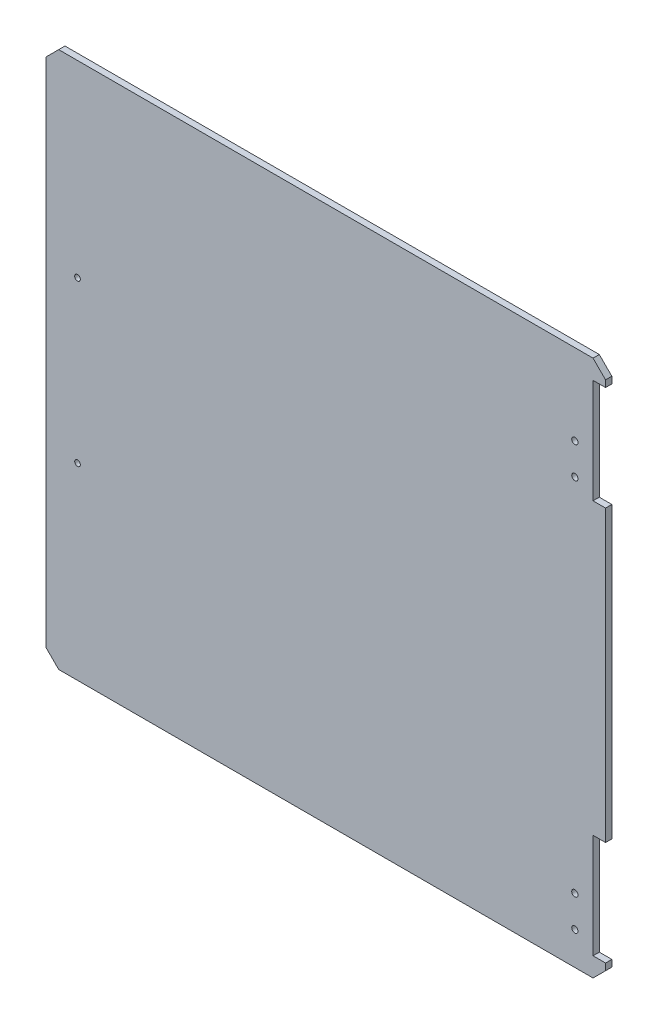
from build123d import *

# Parameters (mm, degrees)
SCHIZZO1_R                   = 2.5
SCHIZZO1_R_2                 = 2.499072061
SCHIZZO1_R_3                 = 2.25
ESTRUSIONE_ESTRUSIONE1_DEPTH = 5


with BuildPart() as part:
    # Schizzo1 → Estrusione-Estrusione1 (new body)
    with BuildSketch(Plane.XY):
        Polygon((-223, 204), (-213, 214), (213, 214), (223, 204), (223, 198.658355402), (213, 198.658355402), (213, 115.470714491), (223, 115.470714491), (223, -115.470714491), (213, -115.470714491), (213, -198.658355402), (223, -198.658355402), (223, -204), (213, -214), (-213, -214), (-223, -204), align=None)
        with Locations((198.51797805, 149.65244957)):
            Circle(SCHIZZO1_R, mode=Mode.SUBTRACT)
        with Locations((198.51797805, 124.65244957)):
            Circle(SCHIZZO1_R, mode=Mode.SUBTRACT)
        with Locations((198.494140307, -162.747561795)):
            Circle(SCHIZZO1_R_2, mode=Mode.SUBTRACT)
        with Locations((198.51797805, -187.74755043)):
            Circle(SCHIZZO1_R_2, mode=Mode.SUBTRACT)
        with Locations((-198, 64)):
            Circle(SCHIZZO1_R_3, mode=Mode.SUBTRACT)
        with Locations(Location((-198, -64, 0), (0, 0, 180))):
            Circle(SCHIZZO1_R_3, mode=Mode.SUBTRACT)
    extrude(amount=ESTRUSIONE_ESTRUSIONE1_DEPTH)


solid = part.part
